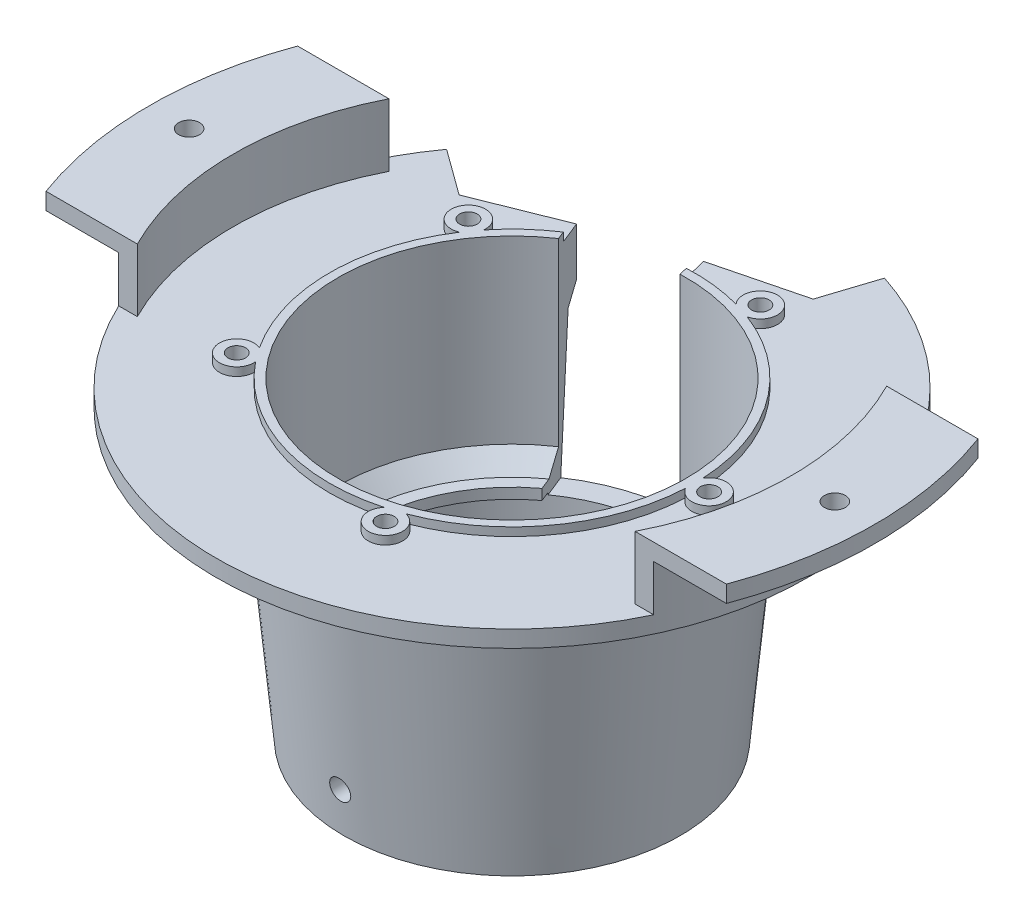
from build123d import *

# Parameters (mm, degrees)
SKETCH2_R               = 2.5
CUT_EXTRUDE3_DEPTH      = 4
CUT_EXTRUDE4_REACH      = 152.402
CUT_EXTRUDE6_DEPTH      = 134.074227407
CUT_EXTRUDE6_DEPTH_BACK = 134.074227407
SKETCH6_R               = 2.5
CUT_EXTRUDE7_REACH      = 135.074
SKETCH7_R               = 2.1
CIRPATTERN1_COUNT       = 5
BOSS_EXTRUDE1_START     = 2
SKETCH8_R               = 41.5
SKETCH8_R_2             = 2.1
BOSS_EXTRUDE1_DEPTH     = 2
CUT_EXTRUDE8_DEPTH      = 135.174326959
CUT_EXTRUDE8_DEPTH_BACK = 50


with BuildPart() as part:
    # Sketch1 → Revolve1 (revolve)
    with BuildSketch(Plane.XY, mode=Mode.PRIVATE) as revolve1_sk:
        Polygon((-70.5, -4), (-70.5, 11), (-86.5, 11), (-86.5, 15), (-66.5, 15), (-66.5, 0), (-41.5, 0), (-41.5, -41), (-37.5, -45), (-34.6, -45), (-34.6, -47.5), (-37.1, -47.5), (-37.1, -72.5), (-40.1, -72.5), (-45.5, -15), (-56.5, -4), align=None)
    revolve(revolve1_sk.sketch.rotate(Axis((0, -100.5, 0), (0, 1, 0)), 270), axis=Axis((0, -100.5, 0), (0, 1, 0)))

    # Sketch2 → Cut-Extrude3 (cut)
    with BuildSketch(Plane.XZ.offset(-11)):
        with Locations(Location((77, 0, 0), (0, 0, 270))):
            Circle(SKETCH2_R)
        with Locations(Location((-77, 0, 0), (0, 0, 270))):
            Circle(SKETCH2_R)
    extrude(amount=-CUT_EXTRUDE3_DEPTH, mode=Mode.SUBTRACT)

    # Cut-Extrude4: up to this face of the body (flat: up to its plane)
    cut_extrude4_end = Plane(part.part.faces().sort_by_distance((0, 0, 64.619095962))[0])
    # Sketch3 → Cut-Extrude4 (cut, up to the picked face)
    with BuildSketch(Plane(origin=(0, 15, 0), x_dir=(1, 0, 0), z_dir=(0, 1, 0)), mode=Mode.PRIVATE) as cut_extrude4_sk1:
        with BuildLine():
            Line((-59.348546739, -30), (-81.131066799, -30))
            ThreePointArc((-81.131066799, -30), (0, -86.5), (81.131066799, -30))
            Line((81.131066799, -30), (59.348546739, -30))
            ThreePointArc((59.348546739, -30), (0, -66.5), (-59.348546739, -30))
        make_face()
    cut_extrude4_tool1 = split(extrude(cut_extrude4_sk1.sketch, amount=-CUT_EXTRUDE4_REACH, mode=Mode.PRIVATE), bisect_by=cut_extrude4_end, keep=Keep.BOTH, mode=Mode.PRIVATE)
    # Sketch3 → Cut-Extrude4 (cut, up to the picked face)
    with BuildSketch(Plane(origin=(0, 15, 0), x_dir=(1, 0, 0), z_dir=(0, 1, 0)), mode=Mode.PRIVATE) as cut_extrude4_sk2:
        with BuildLine():
            Line((81.131066799, 30), (59.348546739, 30))
            ThreePointArc((59.348546739, 30), (0, 66.5), (-59.348546739, 30))
            Line((-59.348546739, 30), (-81.131066799, 30))
            ThreePointArc((-81.131066799, 30), (0, 86.5), (81.131066799, 30))
        make_face()
    cut_extrude4_tool2 = split(extrude(cut_extrude4_sk2.sketch, amount=-CUT_EXTRUDE4_REACH, mode=Mode.PRIVATE), bisect_by=cut_extrude4_end, keep=Keep.BOTH, mode=Mode.PRIVATE)
    add(cut_extrude4_tool1.solids().sort_by(Axis((70.239807, 15, 31.718175), (0, -1, 0)))[0], mode=Mode.SUBTRACT)
    add(cut_extrude4_tool2.solids().sort_by(Axis((0, 15, -84.781825), (0, -1, 0)))[0], mode=Mode.SUBTRACT)

    # Sketch6 → Cut-Extrude6 (cut, two sides: drawn at the far end of the back side and taken through both)
    with BuildSketch(Plane.XY.offset(-CUT_EXTRUDE6_DEPTH_BACK)):
        with Locations((0, -62.5)):
            Circle(SKETCH6_R)
    extrude(amount=CUT_EXTRUDE6_DEPTH + CUT_EXTRUDE6_DEPTH_BACK, mode=Mode.SUBTRACT)

    # Cut-Extrude7: up to this cone (the profile starts inside it)
    cut_extrude7_end = Plane(origin=(0, 0, 0), z_dir=(0, 1, 0)).offset(-60.499999) * Cone(1e-06, 256.574, 256.573999, align=(Align.CENTER, Align.CENTER, Align.MIN), mode=Mode.PRIVATE)
    # Sketch7 → Cut-Extrude7 (cut, up to the surface)
    with BuildSketch(Plane(origin=(0, 0, 0), x_dir=(1, 0, 0), z_dir=(0, 1, 0)), mode=Mode.PRIVATE) as cut_extrude7_sk1:
        with Locations(Location((47, 0, 0), (0, 0, 270))):
            Circle(SKETCH7_R)
    cut_extrude7_tool1 = extrude(cut_extrude7_sk1.sketch, amount=-CUT_EXTRUDE7_REACH, mode=Mode.PRIVATE) & cut_extrude7_end
    cut_extrude7 = cut_extrude7_tool1.solids().sort_by_distance((47, 0, 0))[0]
    add(cut_extrude7, mode=Mode.SUBTRACT)

    # CirPattern1: Cut-Extrude7 ×5 about axis
    cirpattern1_axis = Axis((0, 0, 0), (0, 1, 0))
    for i in range(1, CIRPATTERN1_COUNT):
        add(cut_extrude7.rotate(cirpattern1_axis, i * 360 / CIRPATTERN1_COUNT), mode=Mode.SUBTRACT)

    # Sketch8 → Boss-Extrude1 (add)
    with BuildSketch(Plane(origin=(0, 0, 0), x_dir=(1, 0, 0), z_dir=(0, 1, 0)).offset(BOSS_EXTRUDE1_START)):
        with BuildLine():
            ThreePointArc((-33.945803149, -27.20169937), (-26.40364795, -34.57018043), (-17.310153819, -39.907500232))
            ThreePointArc((-17.310153819, -39.907500232), (-3.09320283, -43.389884723), (11.473973908, -41.959479534))
            ThreePointArc((11.473973908, -41.959479534), (15.790768413, -48.598987983), (15.380523379, -40.690164667))
            ThreePointArc((15.380523379, -40.690164667), (35.192239255, -25.568658475), (43.451489362, -2.053794598))
            ThreePointArc((43.451489362, -2.053794598), (51.1, 0), (43.451489362, 2.053794598))
            ThreePointArc((43.451489362, 2.053794598), (35.192239255, 25.568658475), (15.380523379, 40.690164667))
            ThreePointArc((15.380523379, 40.690164667), (15.790768413, 48.598987983), (11.473973908, 41.959479534))
            ThreePointArc((11.473973908, 41.959479534), (-13.442239255, 41.370958459), (-33.945803149, 27.20169937))
            ThreePointArc((-33.945803149, 27.20169937), (-41.340768413, 30.035826392), (-36.3601835, 23.878589904))
            ThreePointArc((-36.3601835, 23.878589904), (-43.5, 0), (-36.3601835, -23.878589904))
            ThreePointArc((-36.3601835, -23.878589904), (-41.340768413, -30.035826392), (-33.945803149, -27.20169937))
        make_face()
        with Locations(Location((0, 0, 0), (0, 0, 90))):
            Circle(SKETCH8_R, mode=Mode.SUBTRACT)
        with Locations(Location((-38.023798736, -27.625906858, 0), (0, 0, 270))):
            Circle(SKETCH8_R_2, mode=Mode.SUBTRACT)
        with Locations(Location((14.523798736, -44.699656266, 0), (0, 0, 270))):
            Circle(SKETCH8_R_2, mode=Mode.SUBTRACT)
        with Locations(Location((47, 0, 0), (0, 0, 270))):
            Circle(SKETCH8_R_2, mode=Mode.SUBTRACT)
        with Locations(Location((14.523798736, 44.699656266, 0), (0, 0, 270))):
            Circle(SKETCH8_R_2, mode=Mode.SUBTRACT)
        with Locations(Location((-38.023798736, 27.625906858, 0), (0, 0, 270))):
            Circle(SKETCH8_R_2, mode=Mode.SUBTRACT)
    extrude(amount=-BOSS_EXTRUDE1_DEPTH)

    # Sketch9 → Cut-Extrude8 (cut, two sides: drawn at the far end of the back side and taken through both)
    with BuildSketch(Plane(origin=(0, 2, 0), x_dir=(1, 0, 0), z_dir=(0, 1, 0)).offset(-CUT_EXTRUDE8_DEPTH_BACK)):
        Polygon((-26.113968679, 41.503759381), (-46.113968679, 33.503759381), (-57.035698103, 41.438860287), (-45.805840693, 62.945404071), (-23.265587716, 71.604116297), (0.059323349, 77.847899239), (21.785698103, 67.049484399), (17.613968679, 54.210221429), (-3.268653226, 48.926652338), (1.719062791, 29.213351352), (-18.561928107, 22.62365795), align=None)
    extrude(amount=CUT_EXTRUDE8_DEPTH + CUT_EXTRUDE8_DEPTH_BACK, mode=Mode.SUBTRACT)


solid = part.part
